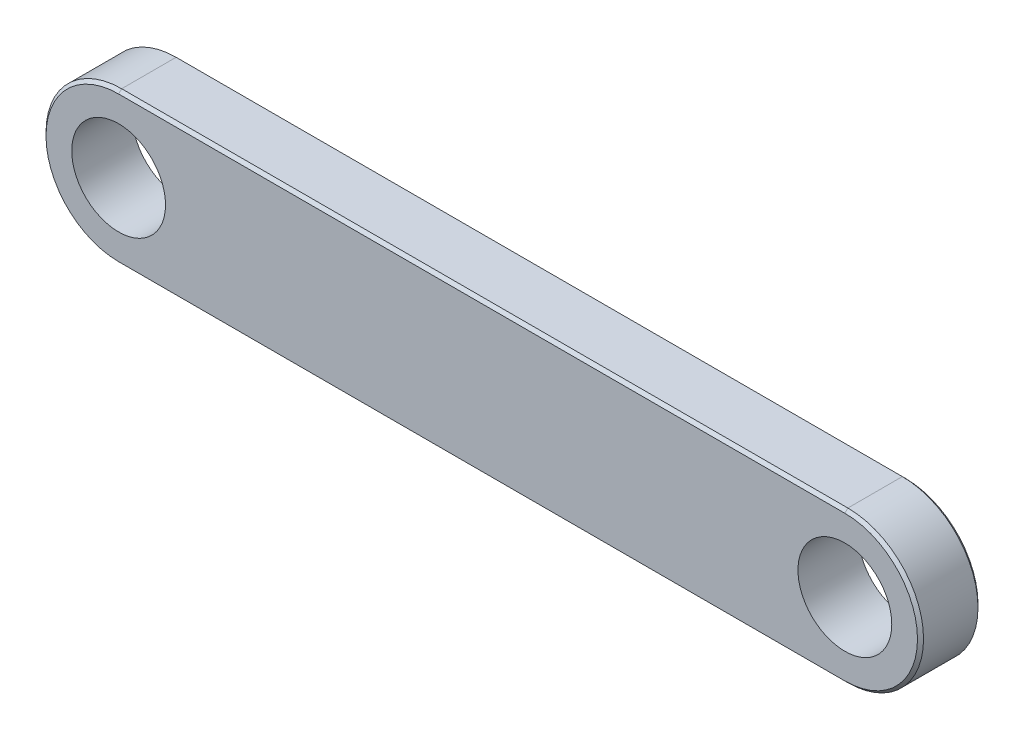
from build123d import *

# Parameters (mm, degrees)
SKETCH1_R           = 1.55
BOSS_EXTRUDE1_DEPTH = 2
CHAMFER1_SIZE       = 0.1


with BuildPart() as part:
    # Sketch1 → Boss-Extrude1 (new body)
    with BuildSketch(Plane.XY):
        with BuildLine():
            Line((-11.929744939, 2.5), (12.070255061, 2.5))
            ThreePointArc((12.070255061, 2.5), (14.570255061, 0), (12.070255061, -2.5))
            Line((12.070255061, -2.5), (-11.929744939, -2.5))
            ThreePointArc((-11.929744939, -2.5), (-14.429744939, 0), (-11.929744939, 2.5))
        make_face()
        with Locations((12.070255061, 0)):
            Circle(SKETCH1_R, mode=Mode.SUBTRACT)
        with Locations((-11.929744939, 0)):
            Circle(SKETCH1_R, mode=Mode.SUBTRACT)
    extrude(amount=BOSS_EXTRUDE1_DEPTH)

    # Chamfer1
    chamfer1_edges = [part.edges().sort_by_distance(p)[0] for p in [
        (14.570255061, 0, 2),
        (0.070255061, 2.5, 2),
        (-14.429744939, 0, 2),
        (0.070255061, 2.5, 0),
        (14.570255061, 0, 0),
        (0.070255061, -2.5, 0),
        (-14.429744939, 0, 0),
        (0.070255061, -2.5, 2),
    ]]
    chamfer(chamfer1_edges, length=CHAMFER1_SIZE)


solid = part.part
